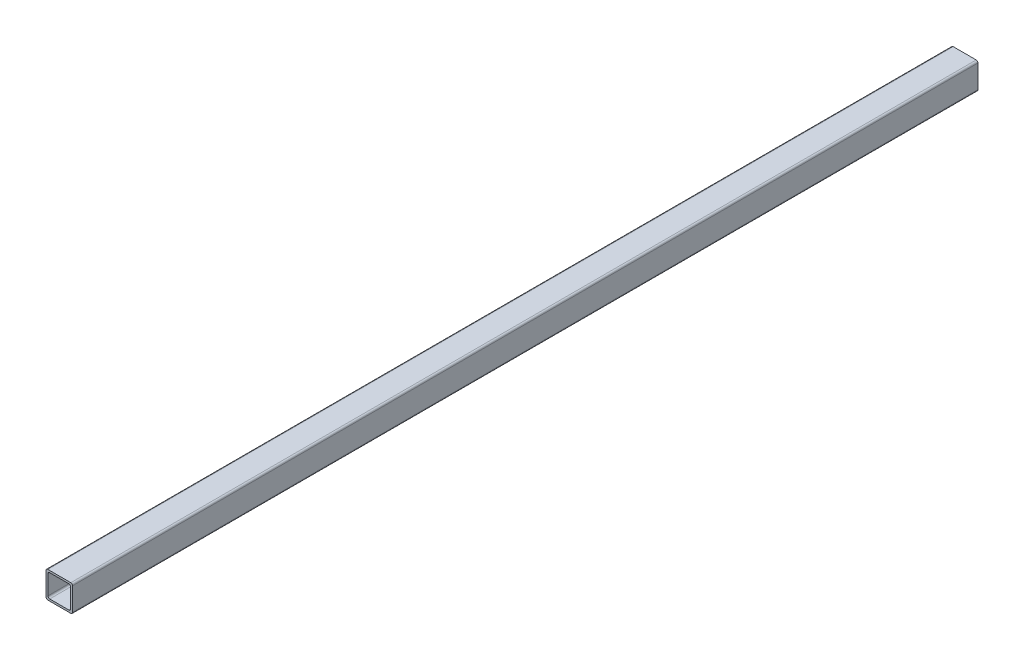
from build123d import *

# Parameters (mm, degrees)
BOSS_EXTRUDE1_DEPTH     = 1500
CUT_EXTRUDE3_DEPTH      = 1501.967428028
CUT_EXTRUDE3_DEPTH_BACK = 1501.967428028
SKETCH2_W               = 432.224270186
SKETCH2_H               = 1076.950896283
SKETCH2_W_2             = 908.538956416
SKETCH2_H_2             = 1717.469993805


with BuildPart() as part:
    # Sketch1 → Boss-Extrude1 (new body)
    with BuildSketch(Plane.XY):
        with BuildLine():
            Line((2.54, 0), (35.56, 0))
            ThreePointArc((35.56, 0), (37.356051224, -0.743948776), (38.1, -2.54))
            Line((38.1, -2.54), (38.1, -35.56))
            ThreePointArc((38.1, -35.56), (37.356051224, -37.356051224), (35.56, -38.1))
            Line((35.56, -38.1), (2.54, -38.1))
            ThreePointArc((2.54, -38.1), (0.743948776, -37.356051224), (0, -35.56))
            Line((0, -35.56), (0, -2.54))
            ThreePointArc((0, -2.54), (0.743948776, -0.743948776), (2.54, 0))
        make_face()
        with BuildLine():
            Line((5.3086, -2.7686), (32.7914, -2.7686))
            ThreePointArc((32.7914, -2.7686), (34.587451224, -3.512548776), (35.3314, -5.3086))
            Line((35.3314, -5.3086), (35.3314, -32.7914))
            ThreePointArc((35.3314, -32.7914), (34.587451224, -34.587451224), (32.7914, -35.3314))
            Line((32.7914, -35.3314), (5.3086, -35.3314))
            ThreePointArc((5.3086, -35.3314), (3.512548776, -34.587451224), (2.7686, -32.7914))
            Line((2.7686, -32.7914), (2.7686, -5.3086))
            ThreePointArc((2.7686, -5.3086), (3.512548776, -3.512548776), (5.3086, -2.7686))
        make_face(mode=Mode.SUBTRACT)
    extrude(amount=BOSS_EXTRUDE1_DEPTH)

    # Sketch2 → Cut-Extrude3 (cut, two sides: drawn at the far end of the back side and taken through both)
    with BuildSketch(Plane.ZY.offset(-CUT_EXTRUDE3_DEPTH_BACK)):
        with Locations((-216.112135093, 500.375448142)):
            Rectangle(SKETCH2_W, SKETCH2_H)
        with Locations((1751.205155953, -66.993484906)):
            Rectangle(SKETCH2_W_2, SKETCH2_H_2)
    extrude(amount=CUT_EXTRUDE3_DEPTH + CUT_EXTRUDE3_DEPTH_BACK, mode=Mode.SUBTRACT)


solid = part.part
